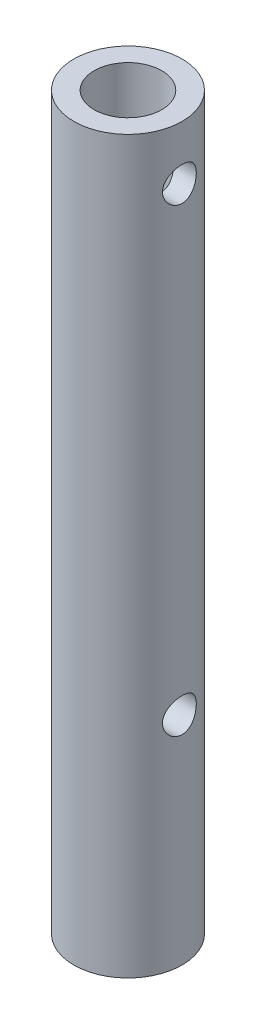
from build123d import *

# Parameters (mm, degrees)
SKETCH1_R                   = 4
BOSS_EXTRUDE1_DEPTH         = 54
F_5_0MM_DOWEL_HOLE2_D       = 5
F_5_0MM_DOWEL_HOLE2_DEPTH   = 20
F_5_0MM_DOWEL_HOLE2_TIP     = 1.502151548
SKETCH14_W                  = 1.25
SKETCH14_H                  = 4
TAP_DRILL_FOR_M3X0_5_TAP4_D = 2.5


with BuildPart() as part:
    # Sketch1 → Boss-Extrude1 (new body)
    with BuildSketch(Plane(origin=(0, 0, 0), x_dir=(1, 0, 0), z_dir=(0, 1, 0))):
        with Locations(Location((0, 0, 0), (0, 0, 270))):
            Circle(SKETCH1_R)
    extrude(amount=BOSS_EXTRUDE1_DEPTH)

    # Ø5.0mm Dowel Hole2
    with Locations(Plane.ZX.offset(54)):
        with Locations((0, 0)):
            Hole(F_5_0MM_DOWEL_HOLE2_D / 2, depth=F_5_0MM_DOWEL_HOLE2_DEPTH)
            with Locations((0, 0, -(F_5_0MM_DOWEL_HOLE2_DEPTH + F_5_0MM_DOWEL_HOLE2_TIP / 2))):  # 118° drill point
                Cone(0, F_5_0MM_DOWEL_HOLE2_D / 2, F_5_0MM_DOWEL_HOLE2_TIP, mode=Mode.SUBTRACT)

    # Sketch12 → Tap Drill for M3x0.5 Tap2 (revolve, cut)
    with BuildSketch(Plane.ZX.offset(50)):
        Polygon((0, 0), (0, 20.751075774), (1.25, 20), (1.25, 0), align=None)
    revolve(axis=Axis((-6.35, 50, 0), (1, 0, 0)), mode=Mode.SUBTRACT)

    # Sketch14 → Tap Drill for M3x0.5 Tap3 (revolve, cut)
    with BuildSketch(Plane.ZX.offset(16)):
        with Locations((0.625, 2)):
            Rectangle(SKETCH14_W, SKETCH14_H)
    revolve(axis=Axis((-6.35, 16, 0), (1, 0, 0)), mode=Mode.SUBTRACT)

    # Tap Drill for M3x0.5 Tap4 (through all)
    with Locations(Plane(origin=(0, 0, 0), x_dir=(0, 0, -1), z_dir=(1, 0, 0))):
        with Locations((0, 16)):
            Hole(TAP_DRILL_FOR_M3X0_5_TAP4_D / 2)


solid = part.part
